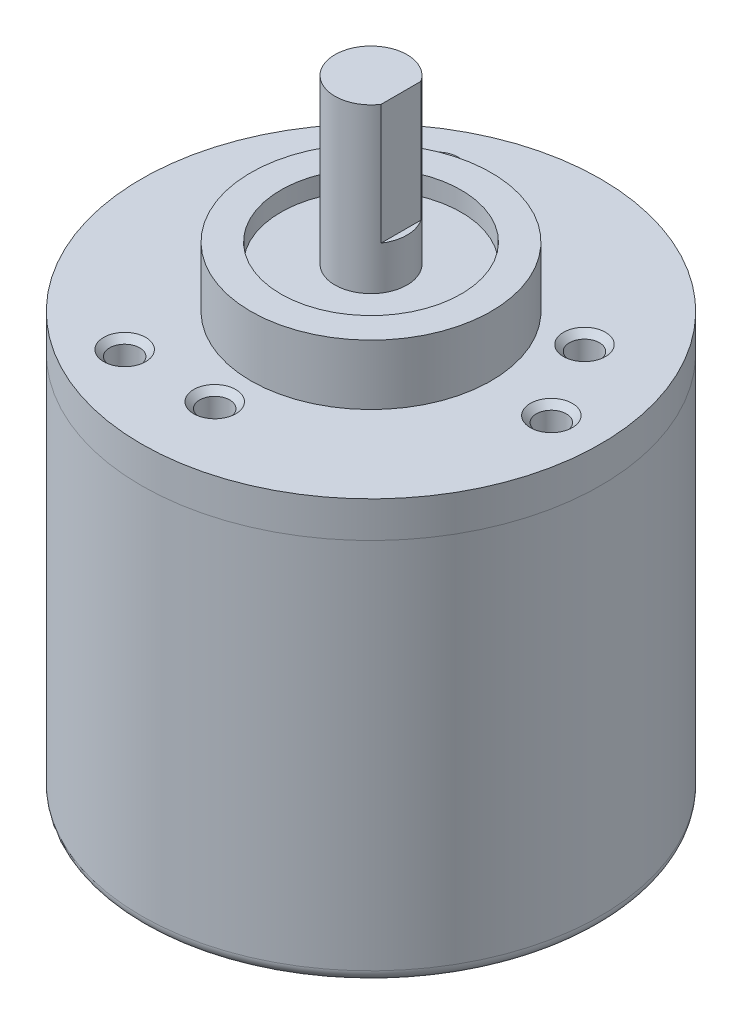
from build123d import *

# Parameters (mm, degrees)
SKETCH1_R            = 19.1
BOSS_EXTRUDE1_DEPTH  = 32
FILLET1_R            = 1
SKETCH3_R            = 19.1
SKETCH3_R_2          = 1.25
BOSS_EXTRUDE6_DEPTH  = 3
SKETCH5_R            = 10
BOSS_EXTRUDE7_DEPTH  = 5
SKETCH7_R            = 7.5
CUT_EXTRUDE1_DEPTH   = 1.6
BOSS_EXTRUDE9_DEPTH  = 13.6
SKETCH8_3_R          = 3
BOSS_EXTRUDE10_DEPTH = 3.6
CHAMFER1_SIZE        = 0.5


with BuildPart() as part:
    # Sketch1 → Boss-Extrude1 (new body)
    with BuildSketch(Plane(origin=(0, 0, 0), x_dir=(1, 0, 0), z_dir=(0, 1, 0))):
        with Locations(Location((0, 0, 0), (0, 0, 270))):
            Circle(SKETCH1_R)
    extrude(amount=BOSS_EXTRUDE1_DEPTH)

    # Fillet1
    fillet1_edges = [part.edges().sort_by_distance(p)[0] for p in [
        (0, 0, -19.1),
    ]]
    fillet(fillet1_edges, radius=FILLET1_R)


with BuildPart() as body_2:
    # Sketch3 → Boss-Extrude6 (new body)
    with BuildSketch(Plane(origin=(0, 32, 0), x_dir=(1, 0, 0), z_dir=(0, 1, 0))):
        with Locations(Location((0, 0, 0), (0, 0, 270))):
            Circle(SKETCH3_R)
        with Locations(Location((15, 0, 0), (0, 0, 270))):
            Circle(SKETCH3_R_2, mode=Mode.SUBTRACT)
        with Locations(Location((-7.5, -12.990381057, 0), (0, 0, 270))):
            Circle(SKETCH3_R_2, mode=Mode.SUBTRACT)
        with Locations(Location((-7.5, 12.990381057, 0), (0, 0, 270))):
            Circle(SKETCH3_R_2, mode=Mode.SUBTRACT)
        with Locations(Location((-6.168e-06, -13, 0), (0, 0, 270))):
            Circle(SKETCH3_R_2, mode=Mode.SUBTRACT)
        with Locations(Location((11.258333333, 6.499994658, 0), (0, 0, 270))):
            Circle(SKETCH3_R_2, mode=Mode.SUBTRACT)
        with Locations(Location((-11.258327165, 6.500005342, 0), (0, 0, 270))):
            Circle(SKETCH3_R_2, mode=Mode.SUBTRACT)
    extrude(amount=BOSS_EXTRUDE6_DEPTH)

    # Chamfer1
    chamfer1_edges = [body_2.edges().sort_by_distance(p)[0] for p in [
        (-11.258327165, 35, -7.750005342),
        (11.258333333, 35, -7.749994658),
        (-7.5, 35, -14.240381057),
        (15, 35, -1.25),
        (-7.5, 35, 11.740381057),
        (-6.168e-06, 35, 11.75),
    ]]
    chamfer(chamfer1_edges, length=CHAMFER1_SIZE)


with BuildPart() as body_3:
    # Sketch5 → Boss-Extrude7 (new body)
    with BuildSketch(Plane(origin=(0, 35, 0), x_dir=(1, 0, 0), z_dir=(0, 1, 0))):
        with Locations(Location((0, 0, 0), (0, 0, 270))):
            Circle(SKETCH5_R)
    extrude(amount=BOSS_EXTRUDE7_DEPTH)

    # Sketch7 → Cut-Extrude1 (cut)
    with BuildSketch(Plane(origin=(0, 40, 0), x_dir=(1, 0, 0), z_dir=(0, 1, 0))):
        with Locations(Location((0, 0, 0), (0, 0, 270))):
            Circle(SKETCH7_R)
    extrude(amount=-CUT_EXTRUDE1_DEPTH, mode=Mode.SUBTRACT)

    # Sketch8 → Boss-Extrude9 (add)
    with BuildSketch(Plane(origin=(0, 38.4, 0), x_dir=(1, 0, 0), z_dir=(0, 1, 0))):
        with BuildLine():
            Line((2.5, -1.658312395), (2.5, 1.658312395))
            ThreePointArc((2.5, 1.658312395), (-3, 0), (2.5, -1.658312395))
        make_face()
    extrude(amount=BOSS_EXTRUDE9_DEPTH)

    # Sketch8<3> → Boss-Extrude10 (add)
    with BuildSketch(Plane(origin=(0, 38.4, 0), x_dir=(1, 0, 0), z_dir=(0, 1, 0))):
        with Locations(Location((0, 0, 0), (0, 0, 33.557309762))):
            Circle(SKETCH8_3_R)
    extrude(amount=BOSS_EXTRUDE10_DEPTH)


solid = Compound([part.part, body_2.part, body_3.part])
